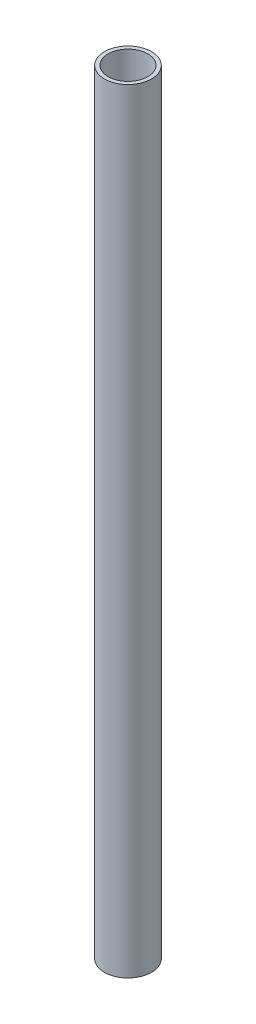
from build123d import *

# Parameters (mm, degrees)
BOSS_EXTRUDE1_DEPTH      = 205
BOSS_EXTRUDE1_DEPTH_BACK = 205
SKETCH1_R                = 12.5
SKETCH1_R_2              = 10.5


with BuildPart() as part:
    # Sketch1 → Boss-Extrude1 (new, two sides: drawn at the far end of the back side and taken through both)
    with BuildSketch(Plane(origin=(0, 0, 0), x_dir=(1, 0, 0), z_dir=(0, 1, 0)).offset(-BOSS_EXTRUDE1_DEPTH_BACK)):
        Circle(SKETCH1_R)
        Circle(SKETCH1_R_2, mode=Mode.SUBTRACT)
    extrude(amount=BOSS_EXTRUDE1_DEPTH + BOSS_EXTRUDE1_DEPTH_BACK)


solid = part.part
